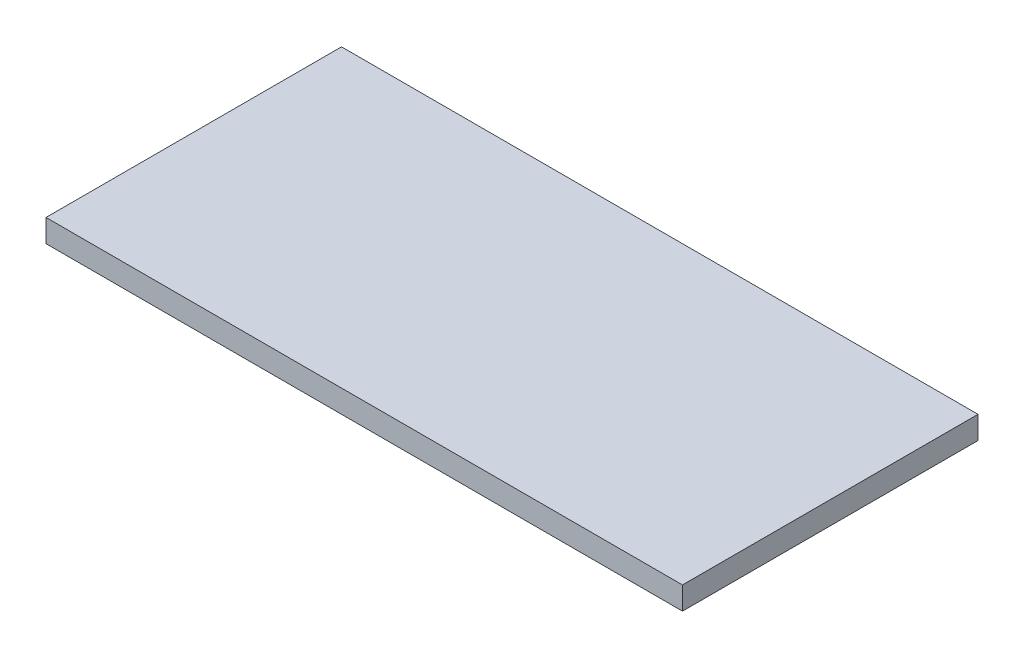
from build123d import *

# Parameters (mm, degrees)
SKETCH1_W           = 280
SKETCH1_H           = 130
BOSS_EXTRUDE1_DEPTH = 10


with BuildPart() as part:
    # Sketch1 → Boss-Extrude1 (new body)
    with BuildSketch(Plane(origin=(0, 0, 0), x_dir=(1, 0, 0), z_dir=(0, 1, 0))):
        Rectangle(SKETCH1_W, SKETCH1_H)
    extrude(amount=BOSS_EXTRUDE1_DEPTH)


solid = part.part
